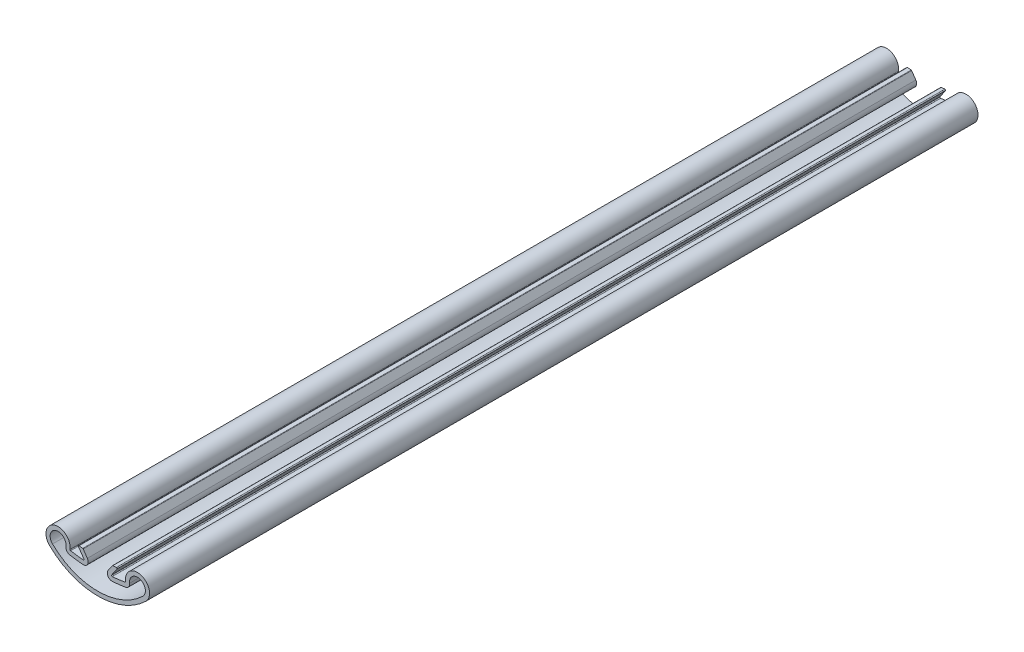
from build123d import *

# Parameters (mm, degrees)
BOSS_EXTRUDE1_DEPTH = 240


with BuildPart() as part:
    # Sketch1 → Boss-Extrude1 (new body)
    with BuildSketch(Plane.XY):
        with BuildLine():
            Line((-4.005405916, -48.006392066), (-5.596014404, -45.690783174))
            ThreePointArc((-5.596014404, -45.690783174), (-5.602314544, -45.474072701), (-5.407495225, -45.378948813))
            ThreePointArc((-5.407495225, -45.378948813), (-4.886118258, -45.438044064), (-4.364097153, -45.491149206))
            ThreePointArc((-4.364097153, -45.491149206), (-4.281696906, -45.51790434), (-4.218342055, -45.576995799))
            Line((-4.218342055, -45.576995799), (-3.016281965, -47.326955674))
            ThreePointArc((-3.016281965, -47.326955674), (-2.9606913, -48.824573862), (-4.291137006, -49.514403391))
            ThreePointArc((-4.291137006, -49.514403391), (-6.183725625, -49.313806762), (-8.067246452, -49.040896553))
            ThreePointArc((-8.067246452, -49.040896553), (-8.970999234, -48.484593683), (-9.22486491, -47.4541597))
            ThreePointArc((-9.22486491, -47.4541597), (-12.237087805, -44.938183329), (-13.103030303, -48.766207291))
            ThreePointArc((-13.103030303, -48.766207291), (0, -54.084716391), (13.103030303, -48.766207291))
            ThreePointArc((13.103030303, -48.766207291), (12.237087805, -44.938183329), (9.22486491, -47.4541597))
            ThreePointArc((9.22486491, -47.4541597), (8.970999234, -48.484593683), (8.067246452, -49.040896553))
            ThreePointArc((8.067246452, -49.040896553), (6.183725625, -49.313806762), (4.291137006, -49.514403391))
            ThreePointArc((4.291137006, -49.514403391), (2.9606913, -48.824573862), (3.016281965, -47.326955674))
            Line((3.016281965, -47.326955674), (4.218342055, -45.576995799))
            ThreePointArc((4.218342055, -45.576995799), (4.281696906, -45.51790434), (4.364097153, -45.491149206))
            ThreePointArc((4.364097153, -45.491149206), (4.886118258, -45.438044064), (5.407495225, -45.378948813))
            ThreePointArc((5.407495225, -45.378948813), (5.602314544, -45.474072701), (5.596014404, -45.690783174))
            Line((5.596014404, -45.690783174), (4.005405916, -48.006392066))
            ThreePointArc((4.005405916, -48.006392066), (3.997464392, -48.220337521), (4.187528064, -48.318884597))
            ThreePointArc((4.187528064, -48.318884597), (6.034420378, -48.123131348), (7.872463841, -47.856810519))
            ThreePointArc((7.872463841, -47.856810519), (8.001571382, -47.777338681), (8.037837907, -47.630133826))
            ThreePointArc((8.037837907, -47.630133826), (12.621655355, -43.801474132), (13.939393939, -49.626727987))
            ThreePointArc((13.939393939, -49.626727987), (0, -55.284716391), (-13.939393939, -49.626727987))
            ThreePointArc((-13.939393939, -49.626727987), (-12.621655355, -43.801474132), (-8.037837907, -47.630133826))
            ThreePointArc((-8.037837907, -47.630133826), (-8.001571382, -47.777338681), (-7.872463841, -47.856810519))
            ThreePointArc((-7.872463841, -47.856810519), (-6.034420378, -48.123131348), (-4.187528064, -48.318884597))
            ThreePointArc((-4.187528064, -48.318884597), (-3.997464392, -48.220337521), (-4.005405916, -48.006392066))
        make_face()
    extrude(amount=-BOSS_EXTRUDE1_DEPTH)


solid = part.part
